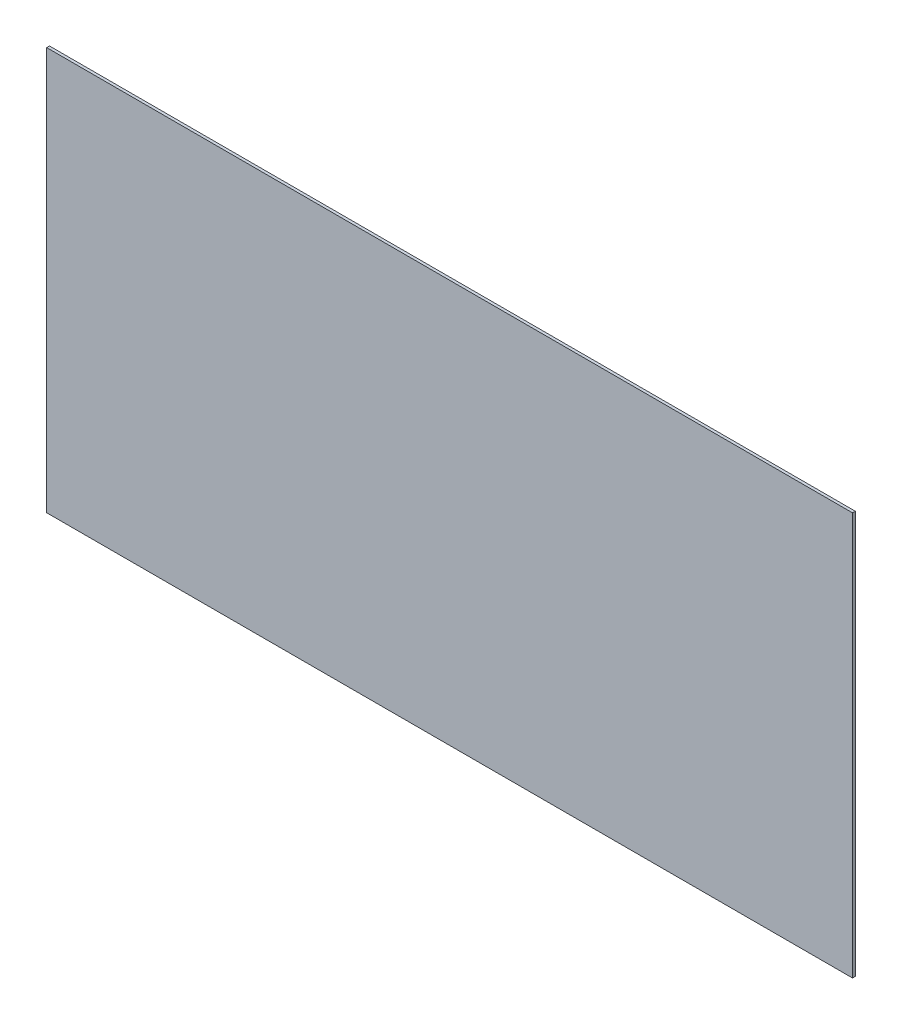
from build123d import *

# Parameters (mm, degrees)
SKETCH1_W           = 1828.8
SKETCH1_H           = 914.4
BOSS_EXTRUDE1_DEPTH = 6.35


with BuildPart() as part:
    # Sketch1 → Boss-Extrude1 (new body)
    with BuildSketch(Plane.XY):
        Rectangle(SKETCH1_W, SKETCH1_H)
    extrude(amount=BOSS_EXTRUDE1_DEPTH)


solid = part.part
